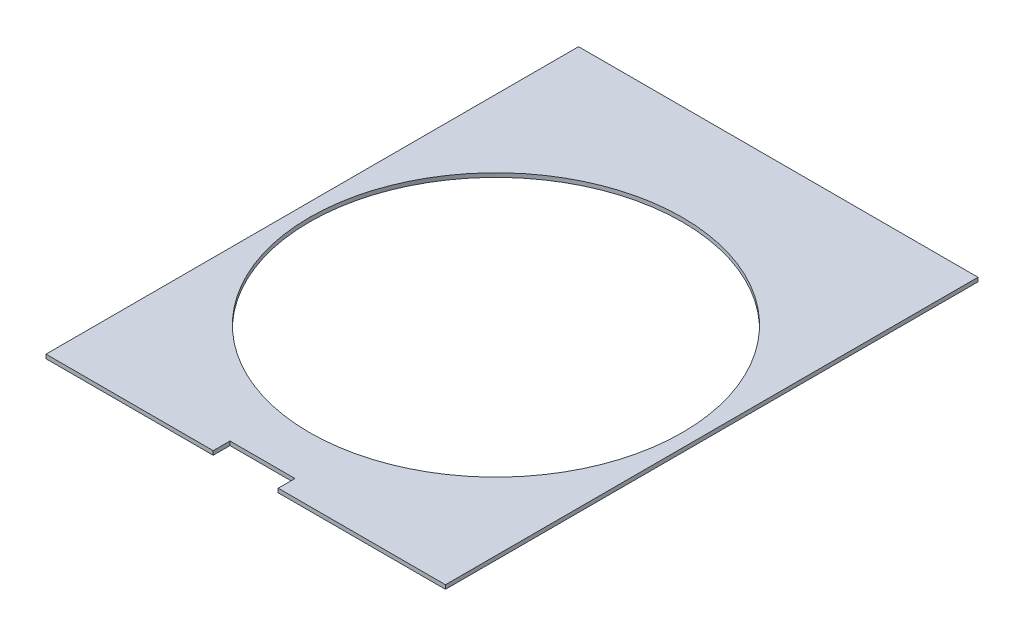
from build123d import *

# Parameters (mm, degrees)
SKETCH4_W           = 381
SKETCH4_H           = 508
BOSS_EXTRUDE1_DEPTH = 3.81
SKETCH5_R           = 177.8
CUT_EXTRUDE1_DEPTH  = 789.432041398
SKETCH6_W           = 62
SKETCH6_H           = 16
CUT_EXTRUDE2_DEPTH  = 789.432041398


with BuildPart() as part:
    # Sketch4 → Boss-Extrude1 (new body)
    with BuildSketch(Plane(origin=(190.463297595, 0, 436.273520924), x_dir=(1, 0, 0), z_dir=(0, 1, 0))):
        Rectangle(SKETCH4_W, SKETCH4_H)
    extrude(amount=BOSS_EXTRUDE1_DEPTH)

    # Sketch5 → Cut-Extrude1 (cut, through all)
    with BuildSketch(Plane(origin=(0, 3.81, 0), x_dir=(1, 0, 0), z_dir=(0, 1, 0))):
        with Locations(Location((190.463297595, -451.583397082, 0), (0, 0, 270))):
            Circle(SKETCH5_R)
    extrude(amount=-CUT_EXTRUDE1_DEPTH, mode=Mode.SUBTRACT)

    # Sketch6 → Cut-Extrude2 (cut, through all)
    with BuildSketch(Plane(origin=(0, 3.81, 0), x_dir=(1, 0, 0), z_dir=(0, 1, 0))):
        with Locations((190.463297595, -682.273520924)):
            Rectangle(SKETCH6_W, SKETCH6_H)
    extrude(amount=-CUT_EXTRUDE2_DEPTH, mode=Mode.SUBTRACT)


solid = part.part
